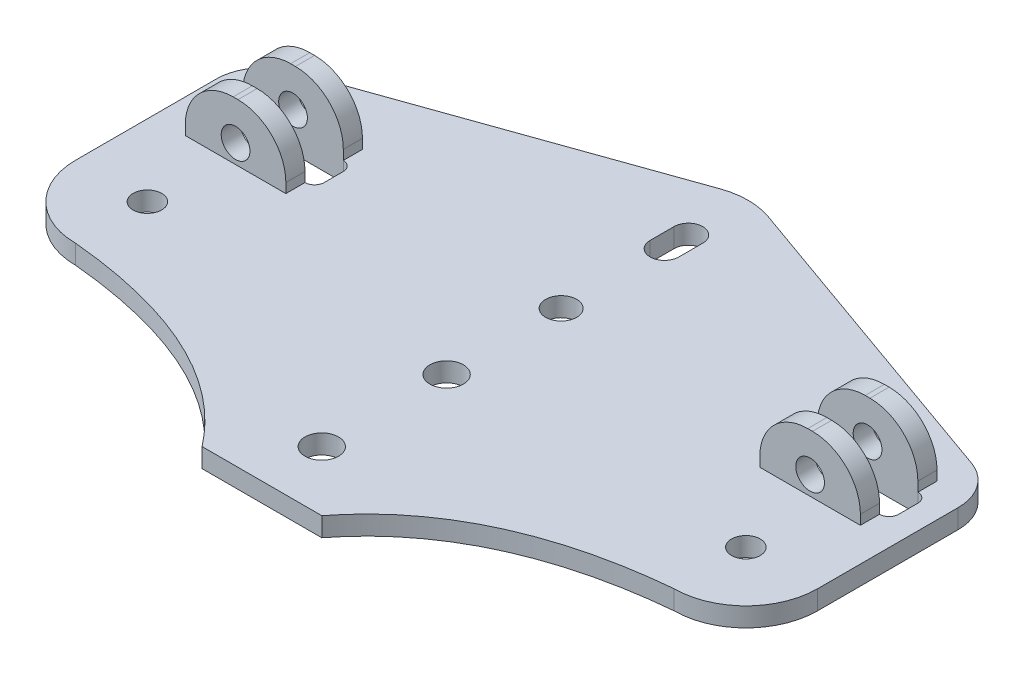
from build123d import *

# Parameters (mm, degrees)
SKETCH2_R              = 3
SKETCH2_R_2            = 3.25
SKETCH2_R_3            = 3.5
MAINPLATEEXTRUDE_DEPTH = 4
SKETCH3_W              = 21
SKETCH3_H              = 4
TOPBEARING_DEPTH       = 12
FILLET1_R              = 10
TOPBEARINGCUT_REACH    = 101.107
SKETCH4_R              = 3


with BuildPart() as part:
    # Sketch2 → MainPlateExtrude (new body)
    with BuildSketch(Plane(origin=(0, 0, 0), x_dir=(1, 0, 0), z_dir=(0, 1, 0))):
        with BuildLine():
            Line((-81.215970545, -46.28367362), (-81.215970545, -16.925572983))
            ThreePointArc((-81.215970545, -16.925572983), (-79.384065752, -11.156498475), (-74.559526408, -7.501103014))
            Line((-74.559526408, -7.501103014), (-8.731304339, 15.853031333))
            ThreePointArc((-8.731304339, 15.853031333), (-3.715970545, 16.71632638), (1.299363248, 15.853031333))
            Line((1.299363248, 15.853031333), (67.127585317, -7.501103014))
            ThreePointArc((67.127585317, -7.501103014), (71.952124662, -11.156498475), (73.784029455, -16.925572983))
            Line((73.784029455, -16.925572983), (73.784029455, -46.28367362))
            ThreePointArc((73.784029455, -46.28367362), (69.390631173, -56.890275338), (58.784029455, -61.28367362))
            add(Edge.make_bspline(
                [(58.784029455, -61.28367362), (24.556467528, -64.469839896), (8.784029455, -84.862635588)],
                knots=[0, 0, 0, 0.615675344, 0.615675344, 0.615675344], degree=2))
            Line((8.784029455, -84.862635588), (-16.215970545, -84.862635588))
            add(Edge.make_bspline(
                [(-66.215970545, -61.28367362), (-31.988408619, -64.469839896), (-16.215970545, -84.862635588)],
                knots=[0, 0, 0, 0.615675344, 0.615675344, 0.615675344], degree=2))
            ThreePointArc((-66.215970545, -61.28367362), (-76.822572263, -56.890275338), (-81.215970545, -46.28367362))
        make_face()
        with Locations(Location((-66.215970545, -46.28367362, 0), (0, 0, 270))):
            Circle(SKETCH2_R, mode=Mode.SUBTRACT)
        with Locations(Location((58.784029455, -46.28367362, 0), (0, 0, 270))):
            Circle(SKETCH2_R, mode=Mode.SUBTRACT)
        with Locations(Location((-3.715970545, -22.362635588, 0), (0, 0, 270))):
            Circle(SKETCH2_R_2, mode=Mode.SUBTRACT)
        with Locations(Location((-3.715970545, -46.28367362, 0), (0, 0, 270))):
            Circle(SKETCH2_R_3, mode=Mode.SUBTRACT)
        with Locations(Location((-3.715970545, -72.362635588, 0), (0, 0, 270))):
            Circle(SKETCH2_R_3, mode=Mode.SUBTRACT)
        with BuildLine():
            Line((-74.215970545, -18.362635588), (-53.215970545, -18.362635588))
            ThreePointArc((-53.215970545, -18.362635588), (-51.801756983, -18.948422026), (-51.215970545, -20.362635588))
            Line((-51.215970545, -20.362635588), (-51.215970545, -24.362635588))
            ThreePointArc((-51.215970545, -24.362635588), (-51.801756983, -25.77684915), (-53.215970545, -26.362635588))
            Line((-53.215970545, -26.362635588), (-74.215970545, -26.362635588))
            ThreePointArc((-74.215970545, -26.362635588), (-75.630184108, -25.77684915), (-76.215970545, -24.362635588))
            Line((-76.215970545, -24.362635588), (-76.215970545, -20.362635588))
            ThreePointArc((-76.215970545, -20.362635588), (-75.630184108, -18.948422026), (-74.215970545, -18.362635588))
        make_face(mode=Mode.SUBTRACT)
        with BuildLine():
            Line((66.784029455, -26.362635588), (45.784029455, -26.362635588))
            ThreePointArc((45.784029455, -26.362635588), (44.369815892, -25.77684915), (43.784029455, -24.362635588))
            Line((43.784029455, -24.362635588), (43.784029455, -20.362635588))
            ThreePointArc((43.784029455, -20.362635588), (44.369815892, -18.948422026), (45.784029455, -18.362635588))
            Line((45.784029455, -18.362635588), (66.784029455, -18.362635588))
            ThreePointArc((66.784029455, -18.362635588), (68.198243017, -18.948422026), (68.784029455, -20.362635588))
            Line((68.784029455, -20.362635588), (68.784029455, -24.362635588))
            ThreePointArc((68.784029455, -24.362635588), (68.198243017, -25.77684915), (66.784029455, -26.362635588))
        make_face(mode=Mode.SUBTRACT)
        with BuildLine():
            Line((-0.715970545, 4.21632638), (-0.715970545, -0.78367362))
            ThreePointArc((-0.715970545, -0.78367362), (-3.715970545, -3.78367362), (-6.715970545, -0.78367362))
            Line((-6.715970545, -0.78367362), (-6.715970545, 4.21632638))
            ThreePointArc((-6.715970545, 4.21632638), (-3.715970545, 7.21632638), (-0.715970545, 4.21632638))
        make_face(mode=Mode.SUBTRACT)
    extrude(amount=MAINPLATEEXTRUDE_DEPTH)

    # Sketch3 → TopBearing (add)
    with BuildSketch(Plane(origin=(0, 4, 0), x_dir=(1, 0, 0), z_dir=(0, 1, 0))):
        with Locations((-63.715970545, -16.362635588)):
            Rectangle(SKETCH3_W, SKETCH3_H)
        with Locations((-63.715970545, -28.362635588)):
            Rectangle(SKETCH3_W, SKETCH3_H)
        with Locations((56.284029455, -28.362635588)):
            Rectangle(SKETCH3_W, SKETCH3_H)
        with Locations((56.284029455, -16.362635588)):
            Rectangle(SKETCH3_W, SKETCH3_H)
    extrude(amount=TOPBEARING_DEPTH)

    # Fillet1
    fillet1_edges = [part.edges().sort_by_distance(p)[0] for p in [
        (-74.215970545, 16, 16.362635588),
        (-53.215970545, 16, 16.362635588),
        (-74.215970545, 16, 28.362635588),
        (-53.215970545, 16, 28.362635588),
        (45.784029455, 16, 28.362635588),
        (66.784029455, 16, 28.362635588),
        (66.784029455, 16, 16.362635588),
        (45.784029455, 16, 16.362635588),
    ]]
    fillet(fillet1_edges, radius=FILLET1_R)

    # TopBearingCut: up to this face of the body (flat: up to its plane)
    topbearingcut_end = Plane(part.part.faces().sort_by_distance((-63.715970545, 9.226840692, 14.362635588))[0])
    # Sketch4 → TopBearingCut (cut, up to the picked face)
    with BuildSketch(Plane.XY.offset(30.362635588), mode=Mode.PRIVATE) as topbearingcut_sk1:
        with Locations((-63.715970545, 7.927390452)):
            Circle(SKETCH4_R)
    topbearingcut_tool1 = split(extrude(topbearingcut_sk1.sketch, amount=-TOPBEARINGCUT_REACH, mode=Mode.PRIVATE), bisect_by=topbearingcut_end, keep=Keep.BOTH, mode=Mode.PRIVATE)
    # Sketch4 → TopBearingCut (cut, up to the picked face)
    with BuildSketch(Plane.XY.offset(30.362635588), mode=Mode.PRIVATE) as topbearingcut_sk2:
        with Locations((56.284029455, 7.927390452)):
            Circle(SKETCH4_R)
    topbearingcut_tool2 = split(extrude(topbearingcut_sk2.sketch, amount=-TOPBEARINGCUT_REACH, mode=Mode.PRIVATE), bisect_by=topbearingcut_end, keep=Keep.BOTH, mode=Mode.PRIVATE)
    add(topbearingcut_tool1.solids().sort_by(Axis((-63.715971, 7.92739, 30.362636), (0, 0, -1)))[0], mode=Mode.SUBTRACT)
    add(topbearingcut_tool2.solids().sort_by(Axis((56.284029, 7.92739, 30.362636), (0, 0, -1)))[0], mode=Mode.SUBTRACT)


solid = part.part
